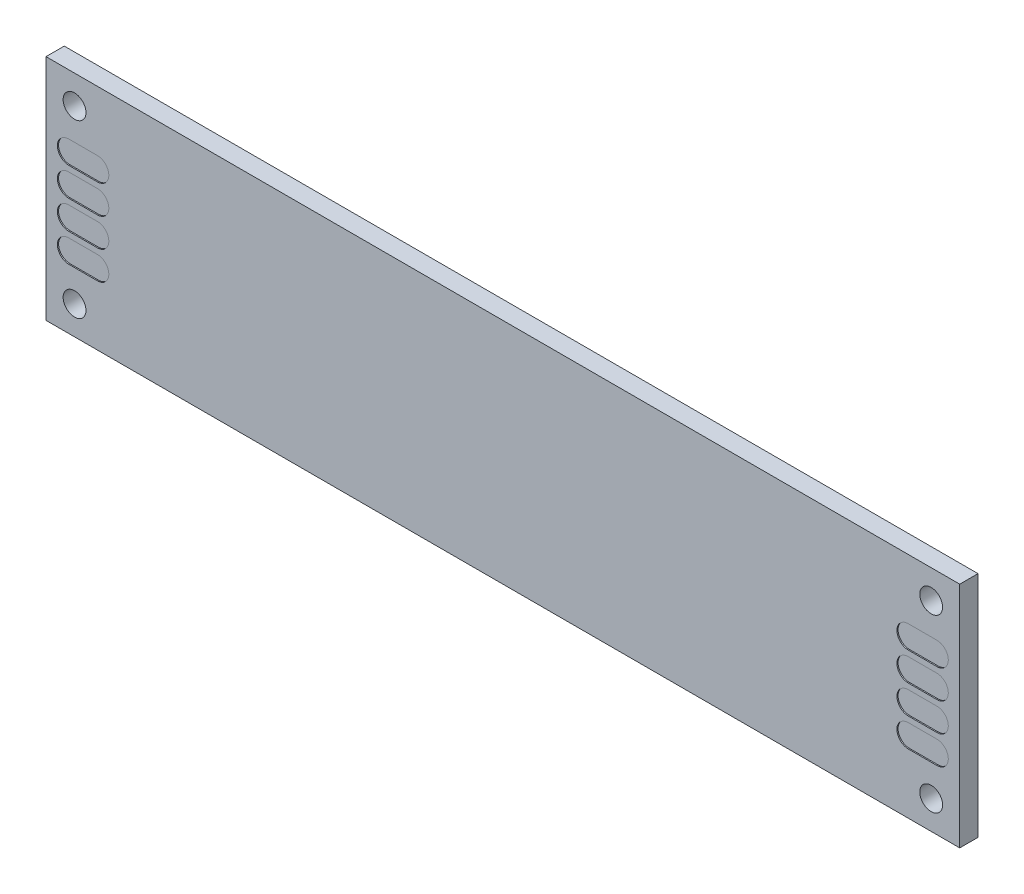
from build123d import *

# Parameters (mm, degrees)
SKETCH_1_W          = 80
SKETCH_1_H          = 20
SKETCH_1_R          = 1
EXTRUDE_1_DEPTH     = 1.6
CUT_EXTRUDE_1_DEPTH = 0.1
CUT_EXTRUDE_START   = -0.1
CUT_EXTRUDE_2_DEPTH = 0.1


with BuildPart() as part:
    # Эскиз1 → Бобышка-Вытянуть1 (new body)
    with BuildSketch(Plane.XY):
        Rectangle(SKETCH_1_W, SKETCH_1_H)
        with Locations((-37.5, 7.5)):
            Circle(SKETCH_1_R, mode=Mode.SUBTRACT)
        with Locations((-37.5, -7.5)):
            Circle(SKETCH_1_R, mode=Mode.SUBTRACT)
        with Locations((37.5, -7.5)):
            Circle(SKETCH_1_R, mode=Mode.SUBTRACT)
        with Locations((37.5, 7.5)):
            Circle(SKETCH_1_R, mode=Mode.SUBTRACT)
    extrude(amount=EXTRUDE_1_DEPTH)

    # Эскиз2 → Вырез-Вытянуть1 (cut)
    with BuildSketch(Plane.XY.offset(1.6)):
        with BuildLine():
            Line((-38, -2.75), (-35.5, -2.75))
            ThreePointArc((-35.5, -2.75), (-34.5, -3.75), (-35.5, -4.75))
            Line((-35.5, -4.75), (-38, -4.75))
            ThreePointArc((-38, -4.75), (-39, -3.75), (-38, -2.75))
        make_face()
        with BuildLine():
            Line((-38, -0.25), (-35.5, -0.25))
            ThreePointArc((-35.5, -0.25), (-34.5, -1.25), (-35.5, -2.25))
            Line((-35.5, -2.25), (-38, -2.25))
            ThreePointArc((-38, -2.25), (-39, -1.25), (-38, -0.25))
        make_face()
        with BuildLine():
            Line((-38, 2.25), (-35.5, 2.25))
            ThreePointArc((-35.5, 2.25), (-34.5, 1.25), (-35.5, 0.25))
            Line((-35.5, 0.25), (-38, 0.25))
            ThreePointArc((-38, 0.25), (-39, 1.25), (-38, 2.25))
        make_face()
        with BuildLine():
            Line((38, -2.75), (35.5, -2.75))
            ThreePointArc((35.5, -2.75), (34.5, -3.75), (35.5, -4.75))
            Line((35.5, -4.75), (38, -4.75))
            ThreePointArc((38, -4.75), (39, -3.75), (38, -2.75))
        make_face()
        with BuildLine():
            Line((-38, 4.75), (-35.5, 4.75))
            ThreePointArc((-35.5, 4.75), (-34.5, 3.75), (-35.5, 2.75))
            Line((-35.5, 2.75), (-38, 2.75))
            ThreePointArc((-38, 2.75), (-39, 3.75), (-38, 4.75))
        make_face()
        with BuildLine():
            Line((38, -0.25), (35.5, -0.25))
            ThreePointArc((35.5, -0.25), (34.5, -1.25), (35.5, -2.25))
            Line((35.5, -2.25), (38, -2.25))
            ThreePointArc((38, -2.25), (39, -1.25), (38, -0.25))
        make_face()
        with BuildLine():
            Line((38, 2.25), (35.5, 2.25))
            ThreePointArc((35.5, 2.25), (34.5, 1.25), (35.5, 0.25))
            Line((35.5, 0.25), (38, 0.25))
            ThreePointArc((38, 0.25), (39, 1.25), (38, 2.25))
        make_face()
        with BuildLine():
            Line((38, 4.75), (35.5, 4.75))
            ThreePointArc((35.5, 4.75), (34.5, 3.75), (35.5, 2.75))
            Line((35.5, 2.75), (38, 2.75))
            ThreePointArc((38, 2.75), (39, 3.75), (38, 4.75))
        make_face()
    extrude(amount=-CUT_EXTRUDE_1_DEPTH, mode=Mode.SUBTRACT)

    # Эскиз3 → Вырез-Вытянуть2 (cut)
    with BuildSketch(Plane(origin=(0, 0, 0), x_dir=(-1, 0, 0), z_dir=(0, 0, -1)).offset(CUT_EXTRUDE_START)):
        with BuildLine():
            Line((38, -0.25), (35.5, -0.25))
            ThreePointArc((35.5, -0.25), (34.5, -1.25), (35.5, -2.25))
            Line((35.5, -2.25), (38, -2.25))
            ThreePointArc((38, -2.25), (39, -1.25), (38, -0.25))
        make_face()
        with BuildLine():
            Line((38, -2.75), (35.5, -2.75))
            ThreePointArc((35.5, -2.75), (34.5, -3.75), (35.5, -4.75))
            Line((35.5, -4.75), (38, -4.75))
            ThreePointArc((38, -4.75), (39, -3.75), (38, -2.75))
        make_face()
        with BuildLine():
            Line((38, 2.25), (35.5, 2.25))
            ThreePointArc((35.5, 2.25), (34.5, 1.25), (35.5, 0.25))
            Line((35.5, 0.25), (38, 0.25))
            ThreePointArc((38, 0.25), (39, 1.25), (38, 2.25))
        make_face()
        with BuildLine():
            Line((-35.5, -0.25), (-38, -0.25))
            ThreePointArc((-38, -0.25), (-39, -1.25), (-38, -2.25))
            Line((-38, -2.25), (-35.5, -2.25))
            ThreePointArc((-35.5, -2.25), (-34.5, -1.25), (-35.5, -0.25))
        make_face()
        with BuildLine():
            Line((-35.5, -2.75), (-38, -2.75))
            ThreePointArc((-38, -2.75), (-39, -3.75), (-38, -4.75))
            Line((-38, -4.75), (-35.5, -4.75))
            ThreePointArc((-35.5, -4.75), (-34.5, -3.75), (-35.5, -2.75))
        make_face()
        with BuildLine():
            Line((-35.5, 2.25), (-38, 2.25))
            ThreePointArc((-38, 2.25), (-39, 1.25), (-38, 0.25))
            Line((-38, 0.25), (-35.5, 0.25))
            ThreePointArc((-35.5, 0.25), (-34.5, 1.25), (-35.5, 2.25))
        make_face()
        with BuildLine():
            Line((38, 4.75), (35.5, 4.75))
            ThreePointArc((35.5, 4.75), (34.5, 3.75), (35.5, 2.75))
            Line((35.5, 2.75), (38, 2.75))
            ThreePointArc((38, 2.75), (39, 3.75), (38, 4.75))
        make_face()
        with BuildLine():
            Line((-35.5, 4.75), (-38, 4.75))
            ThreePointArc((-38, 4.75), (-39, 3.75), (-38, 2.75))
            Line((-38, 2.75), (-35.5, 2.75))
            ThreePointArc((-35.5, 2.75), (-34.5, 3.75), (-35.5, 4.75))
        make_face()
    extrude(amount=CUT_EXTRUDE_2_DEPTH, mode=Mode.SUBTRACT)


solid = part.part
